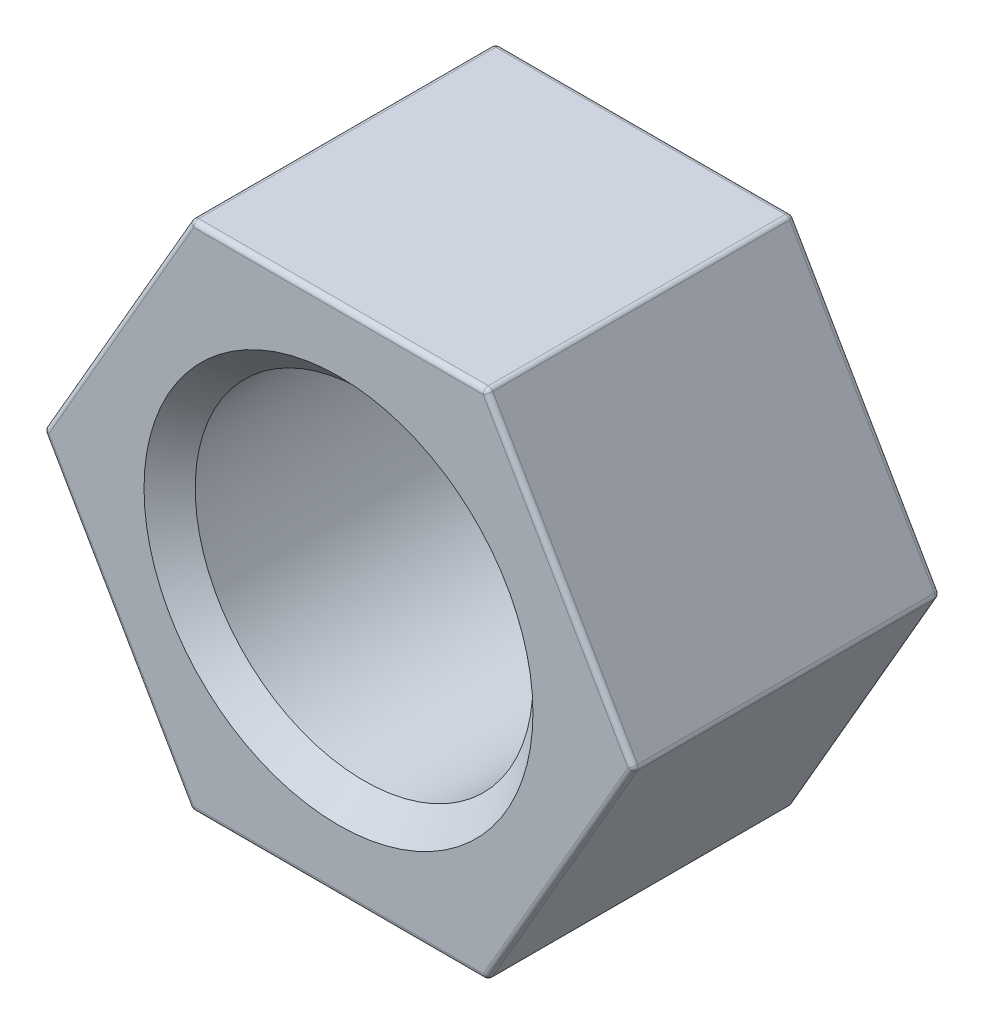
from build123d import *

# Parameters (mm, degrees)
SKETCH1_R           = 3.3
BOSS_EXTRUDE1_DEPTH = 6
FILLET1_R           = 0.1
CHAMFER1_SIZE       = 0.5


with BuildPart() as part:
    # Sketch1 → Boss-Extrude1 (new body)
    with BuildSketch(Plane.XY):
        Polygon((-2.886751346, -5), (2.886751346, -5), (5.773502692, 0), (2.886751346, 5), (-2.886751346, 5), (-5.773502692, 0), align=None)
        Circle(SKETCH1_R, mode=Mode.SUBTRACT)
    extrude(amount=BOSS_EXTRUDE1_DEPTH)

    # Fillet1
    fillet1_edges = [part.edges().sort_by_distance(p)[0] for p in [
        (-5.773502692, 0, 3),
        (-2.886751346, 5, 3),
        (2.886751346, 5, 3),
        (5.773502692, 0, 3),
        (2.886751346, -5, 3),
        (-2.886751346, -5, 3),
        (4.330127019, -2.5, 6),
        (4.330127019, 2.5, 6),
        (0, 5, 6),
        (-4.330127019, 2.5, 6),
        (-4.330127019, -2.5, 6),
        (-4.330127019, 2.5, 0),
        (0, 5, 0),
        (4.330127019, 2.5, 0),
        (4.330127019, -2.5, 0),
        (0, -5, 0),
        (-4.330127019, -2.5, 0),
        (0, -5, 6),
    ]]
    fillet(fillet1_edges, radius=FILLET1_R)

    # Chamfer1
    chamfer1_edges = [part.edges().sort_by_distance(p)[0] for p in [
        (-3.3, 0, 0),
        (-3.3, 0, 6),
    ]]
    chamfer(chamfer1_edges, length=CHAMFER1_SIZE)


solid = part.part
